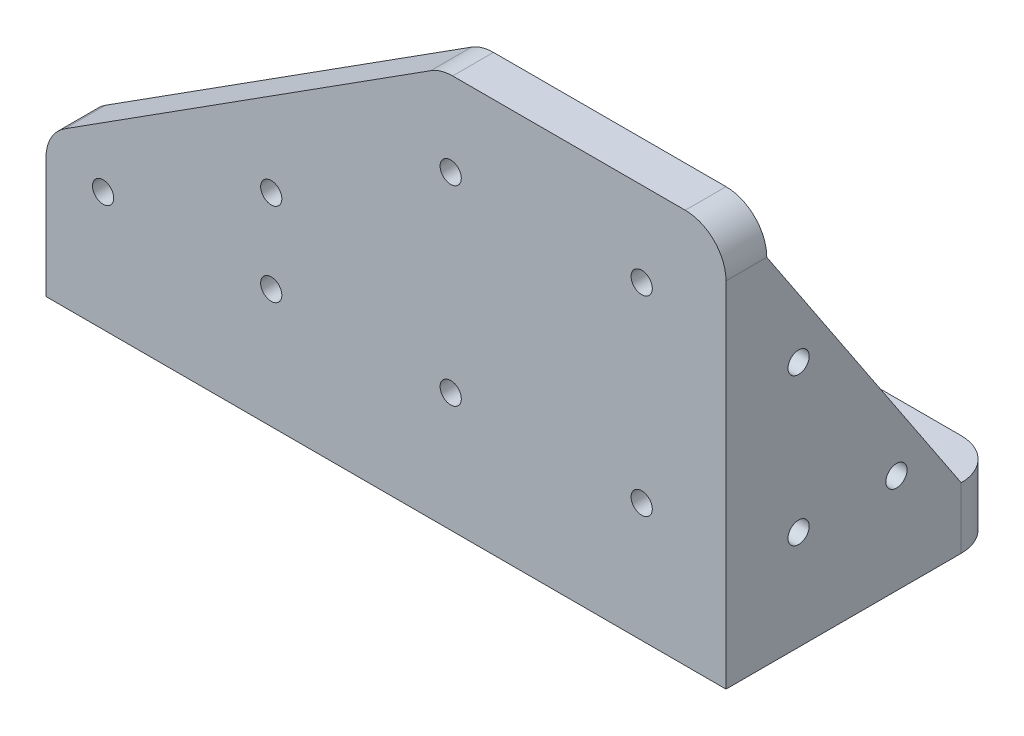
from build123d import *

# Parameters (mm, degrees)
BOSS_EXTRUDE1_DEPTH = 15
CUT_EXTRUDE1_DEPTH  = 10
SKETCH4_R           = 15
SKETCH4_R_2         = 1.6
CUT_EXTRUDE2_DEPTH  = 10
BOSS_EXTRUDE2_DEPTH = 10
BOSS_EXTRUDE3_DEPTH = 10
SKETCH7_R           = 2.6
CUT_EXTRUDE3_DEPTH  = 10
SKETCH8_R           = 2.6
CUT_EXTRUDE4_DEPTH  = 10


with BuildPart() as part:
    # Sketch1 → Boss-Extrude1 (new body)
    with BuildSketch(Plane(origin=(0, 0, 0), x_dir=(1, 0, 0), z_dir=(0, 1, 0))):
        with BuildLine():
            Line((-33.262289521, -33.262289521), (-132.330467636, -33.262289521))
            Line((-132.330467636, -33.262289521), (-132.330467636, -19.482767229))
            ThreePointArc((-132.330467636, -19.482767229), (-130.821698058, -14.200816273), (-126.750666454, -10.512714699))
            Line((-126.750666454, -10.512714699), (-37.682488339, 33.377669927))
            ThreePointArc((-37.682488339, 33.377669927), (-35.531592794, 34.146727348), (-33.262289521, 34.407617396))
            Line((-33.262289521, 34.407617396), (24.407617396, 34.407617396))
            ThreePointArc((24.407617396, 34.407617396), (31.478685208, 31.478685208), (34.407617396, 24.407617396))
            Line((34.407617396, 24.407617396), (34.407617396, -33.262289521))
            Line((34.407617396, -33.262289521), (-33.262289521, -33.262289521))
        make_face()
        with BuildLine():
            Line((-31.892027887, 10.478694381), (-98.33678925, -22.263483514))
            ThreePointArc((-98.33678925, -22.263483514), (-102.487767169, -20.853028863), (-101.077312518, -16.702050945))
            Line((-101.077312518, -16.702050945), (-34.632551154, 16.04012695))
            ThreePointArc((-34.632551154, 16.04012695), (-30.481573236, 14.629672299), (-31.892027887, 10.478694381))
        make_face(mode=Mode.SUBTRACT)
        with BuildLine():
            Line((-123.700729269, -16.702050945), (-34.632551154, 27.188333681))
            ThreePointArc((-34.632551154, 27.188333681), (-30.481573236, 25.77787903), (-31.892027887, 21.626901112))
            Line((-31.892027887, 21.626901112), (-120.960206002, -22.263483514))
            ThreePointArc((-120.960206002, -22.263483514), (-125.11118392, -20.853028863), (-123.700729269, -16.702050945))
        make_face(mode=Mode.SUBTRACT)
        with BuildLine():
            Line((-78.371246836, -16.869773094), (-34.549902224, 4.72419807))
            ThreePointArc((-34.549902224, 4.72419807), (-30.649295385, 3.398816638), (-31.974676817, -0.501790201))
            Line((-31.974676817, -0.501790201), (-75.796021429, -22.095761365))
            ThreePointArc((-75.796021429, -22.095761365), (-79.696628268, -20.770379933), (-78.371246836, -16.869773094))
        make_face(mode=Mode.SUBTRACT)
    extrude(amount=BOSS_EXTRUDE1_DEPTH)

    # Sketch2 → Cut-Extrude1 (cut)
    with BuildSketch(Plane(origin=(0, 15, 0), x_dir=(1, 0, 0), z_dir=(0, 1, 0))):
        Polygon((-17.714466094, 21.25), (-21.25, 17.714466094), (-21.25, -17.714466094), (-17.714466094, -21.25), (17.714466094, -21.25), (21.25, -17.714466094), (21.25, 17.714466094), (17.714466094, 21.25), align=None)
    extrude(amount=-CUT_EXTRUDE1_DEPTH, mode=Mode.SUBTRACT)

    # Sketch4 → Cut-Extrude2 (cut)
    with BuildSketch(Plane(origin=(0, 5, 0), x_dir=(1, 0, 0), z_dir=(0, 1, 0))):
        with Locations(Location((0, 0, 0), (0, 0, 270))):
            Circle(SKETCH4_R)
        with Locations(Location((-15.25, -15.25, 0), (0, 0, 270))):
            Circle(SKETCH4_R_2)
        with Locations(Location((-15.25, 15.25, 0), (0, 0, 270))):
            Circle(SKETCH4_R_2)
        with Locations(Location((15.25, 15.25, 0), (0, 0, 270))):
            Circle(SKETCH4_R_2)
        with Locations(Location((15.25, -15.25, 0), (0, 0, 270))):
            Circle(SKETCH4_R_2)
    extrude(amount=-CUT_EXTRUDE2_DEPTH, mode=Mode.SUBTRACT)

    # Sketch5 → Boss-Extrude2 (add)
    with BuildSketch(Plane.XY.offset(33.262289521)):
        with BuildLine():
            Line((-132.330467636, 15), (-132.330467636, 29.515702772))
            ThreePointArc((-132.330467636, 29.515702772), (-131.098434148, 34.324316216), (-127.705914986, 37.9480551))
            Line((-127.705914986, 37.9480551), (-37.989603896, 95.140317474))
            ThreePointArc((-37.989603896, 95.140317474), (-35.41384195, 96.308056898), (-32.614156546, 96.707965146))
            Line((-32.614156546, 96.707965146), (24.407617396, 96.707965146))
            ThreePointArc((24.407617396, 96.707965146), (31.478685208, 93.779032958), (34.407617396, 86.707965146))
            Line((34.407617396, 86.707965146), (34.407617396, 15))
            Line((34.407617396, 15), (-132.330467636, 15))
        make_face()
    extrude(amount=-BOSS_EXTRUDE2_DEPTH)

    # Sketch6 → Boss-Extrude3 (add)
    with BuildSketch(Plane(origin=(34.407617396, 0, 0), x_dir=(0, 0, -1), z_dir=(1, 0, 0))):
        Polygon((-23.262289521, 86.707965146), (24.407617396, 15), (-23.262289521, 15), align=None)
    extrude(amount=-BOSS_EXTRUDE3_DEPTH)

    # Sketch7 → Cut-Extrude3 (cut)
    with BuildSketch(Plane(origin=(0, 0, 23.262289521), x_dir=(-1, 0, 0), z_dir=(0, 0, -1))):
        with Locations((-13.732807518, 76.033155267)):
            Circle(SKETCH7_R)
        with Locations((33.101778739, 29.198569011)):
            Circle(SKETCH7_R)
        with Locations((33.101778739, 76.033155267)):
            Circle(SKETCH7_R)
        with Locations((-13.732807518, 29.198569011)):
            Circle(SKETCH7_R)
        with Locations((118.329007759, 29.198569011)):
            Circle(SKETCH7_R)
        with Locations((77.104397796, 29.198569011)):
            Circle(SKETCH7_R)
        with Locations((77.104397796, 49.667805409)):
            Circle(SKETCH7_R)
    extrude(amount=-CUT_EXTRUDE3_DEPTH, mode=Mode.SUBTRACT)

    # Sketch8 → Cut-Extrude4 (cut)
    with BuildSketch(Plane.ZY.offset(-24.407617396)):
        with Locations((15.467402897, 24.417657132)):
            Circle(SKETCH8_R)
        with Locations((15.467402897, 60.531845861)):
            Circle(SKETCH8_R)
        with Locations((-8.540529995, 24.417657132)):
            Circle(SKETCH8_R)
    extrude(amount=-CUT_EXTRUDE4_DEPTH, mode=Mode.SUBTRACT)


solid = part.part
